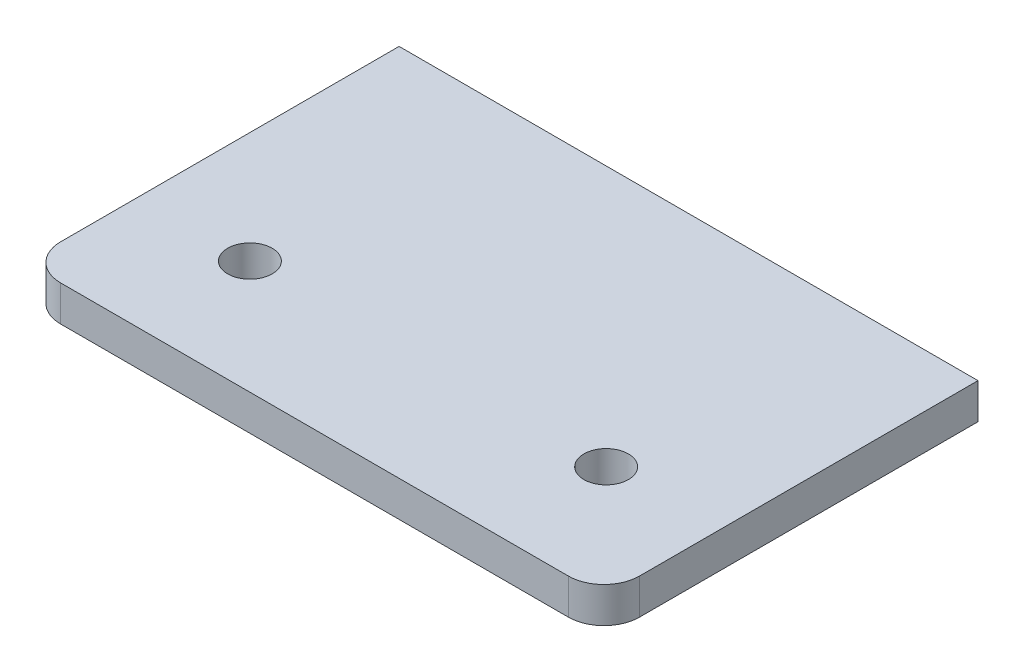
from build123d import *

# Parameters (mm, degrees)
SKETCH1_R           = 2.5
BOSS_EXTRUDE1_DEPTH = 4


with BuildPart() as part:
    # Sketch1 → Boss-Extrude1 (new body)
    with BuildSketch(Plane(origin=(0, 0, 0), x_dir=(1, 0, 0), z_dir=(0, 1, 0))):
        with BuildLine():
            Line((4, 0), (61, 0))
            ThreePointArc((61, 0), (63.828427125, 1.171572875), (65, 4))
            Line((65, 4), (65, 42))
            Line((65, 42), (0, 42))
            Line((0, 42), (0, 4))
            ThreePointArc((0, 4), (1.171572875, 1.171572875), (4, 0))
        make_face()
        with Locations(Location((12.5, 12.75, 0), (0, 0, 270))):
            Circle(SKETCH1_R, mode=Mode.SUBTRACT)
        with Locations(Location((52.5, 12.75, 0), (0, 0, 270))):
            Circle(SKETCH1_R, mode=Mode.SUBTRACT)
    extrude(amount=BOSS_EXTRUDE1_DEPTH)


solid = part.part
